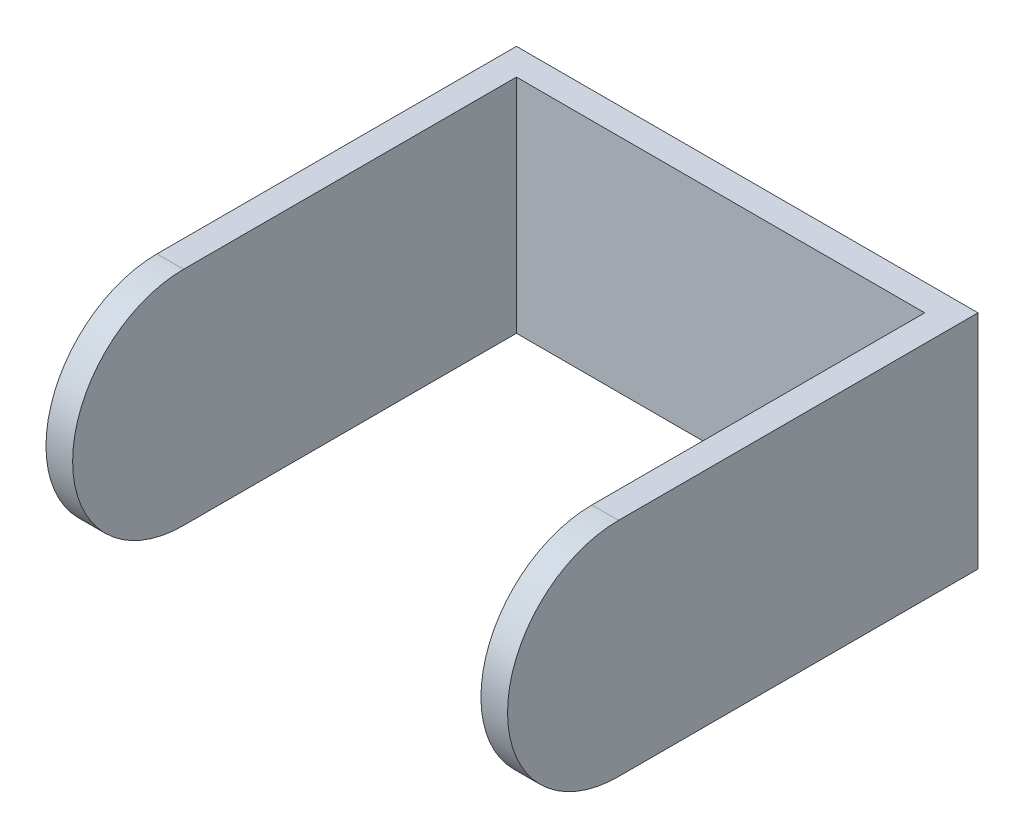
from build123d import *

# Parameters (mm, degrees)
SKETCH_1_W          = 52
SKETCH_1_H          = 25
EXTRUDE_1_DEPTH     = 3
SKETCH_2_W          = 3
SKETCH_2_H          = 25
EXTRUDE_2_DEPTH     = 50
CUT_EXTRUDE_1_DEPTH = 76.294422104


with BuildPart() as part:
    # 스케치1 → 보스-돌출1 (new body)
    with BuildSketch(Plane.XY):
        Rectangle(SKETCH_1_W, SKETCH_1_H)
    extrude(amount=EXTRUDE_1_DEPTH)

    # 스케치2 → 보스-돌출2 (add)
    with BuildSketch(Plane.XY.offset(3)):
        with Locations((-24.5, 0)):
            Rectangle(SKETCH_2_W, SKETCH_2_H)
        with Locations((24.5, 0)):
            Rectangle(SKETCH_2_W, SKETCH_2_H)
    extrude(amount=EXTRUDE_2_DEPTH)

    # 스케치3 → 컷-돌출1 (cut, through all)
    with BuildSketch(Plane(origin=(26, 0, 0), x_dir=(0, 0, -1), z_dir=(1, 0, 0))):
        with BuildLine():
            ThreePointArc((-53, 1.56e-07), (-49.33883471, 8.83883482), (-40.5, 12.5))
            Line((-40.5, 12.5), (-53, 12.5))
            Line((-53, 12.5), (-53, 1.56e-07))
        make_face()
        with BuildLine():
            Line((-53, -12.5), (-40.5, -12.5))
            ThreePointArc((-40.5, -12.5), (-49.33883482, -8.83883471), (-53, 1.56e-07))
            Line((-53, 1.56e-07), (-53, -12.5))
        make_face()
    extrude(amount=-CUT_EXTRUDE_1_DEPTH, mode=Mode.SUBTRACT)


solid = part.part
